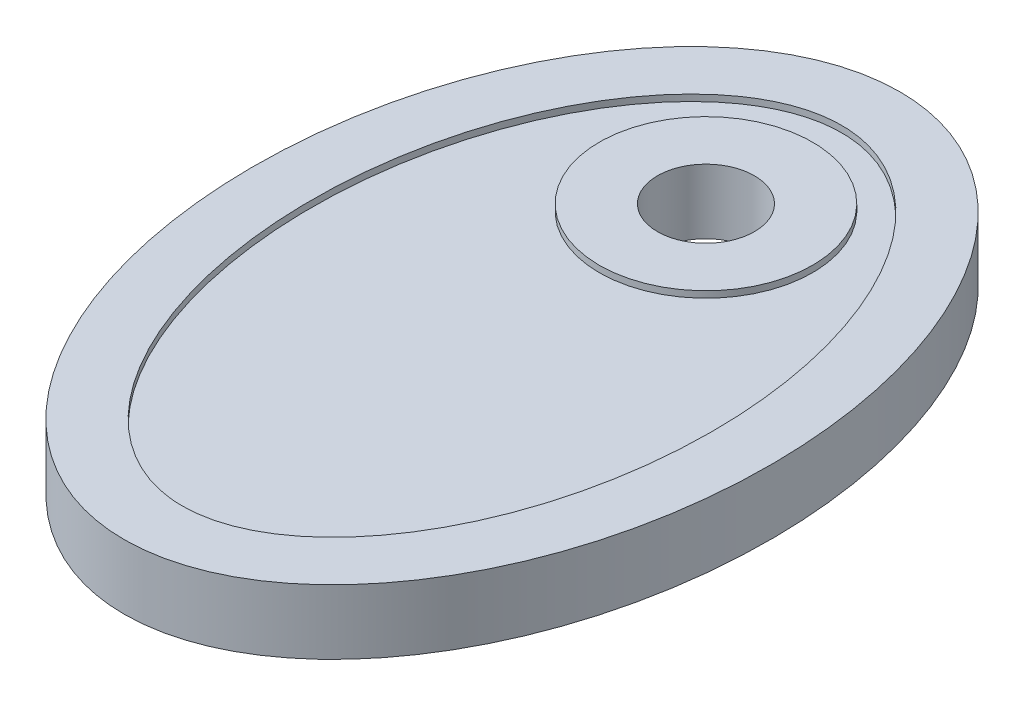
from build123d import *

# Parameters (mm, degrees)
SKETCH1_RX          = 60
SKETCH1_RY          = 40
SKETCH1_RX_2        = 55
SKETCH1_RY_2        = 35
SKETCH1_R           = 7.5
BOSS_EXTRUDE1_DEPTH = 10
SHELL5_T            = -9


with BuildPart() as part:
    # Sketch1 → Boss-Extrude1 (new body)
    # profile 1 of 2: a face of its own
    with BuildSketch(Plane(origin=(0, 0, 0), x_dir=(1, 0, 0), z_dir=(0, 1, 0))):
        with Locations(Location((0, 0), (0, 0, 90))):
            Ellipse(SKETCH1_RX, SKETCH1_RY)
        with Locations(Location((0, 0), (0, 0, 90))):
            Ellipse(SKETCH1_RX_2, SKETCH1_RY_2, mode=Mode.SUBTRACT)
    # profile 2 of 2: a face of its own
    with BuildSketch(Plane(origin=(0, 0, 0), x_dir=(1, 0, 0), z_dir=(0, 1, 0))):
        with Locations(Location((0, 0), (0, 0, 90))):
            Ellipse(SKETCH1_RX_2, SKETCH1_RY_2)
        with Locations(Location((0, 30, 0), (0, 0, 270))):
            Circle(SKETCH1_R, mode=Mode.SUBTRACT)
    extrude(amount=BOSS_EXTRUDE1_DEPTH)

    # Shell5
    shell5_openings = [part.faces().sort_by_distance(p)[0] for p in [
        (0, 10, 0.72),
    ]]
    offset(amount=SHELL5_T, openings=shell5_openings, kind=Kind.INTERSECTION)


solid = part.part
